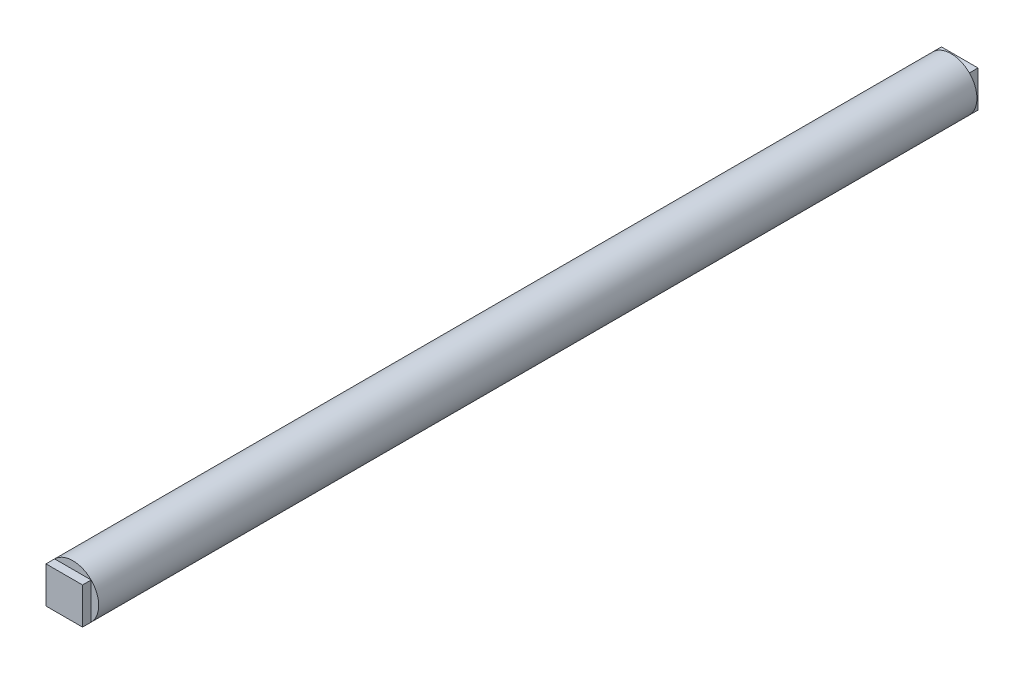
from build123d import *

# Parameters (mm, degrees)
MAIN_BAR_CROSS_SECTION_R = 3
BOSS_EXTRUDE1_DEPTH      = 102
SKETCH2_W                = 4.242640688
SKETCH2_H                = 4.242640688
BOSS_EXTRUDE2_DEPTH      = 1
SKETCH3_W                = 4.24
SKETCH3_H                = 4.245279732
BOSS_EXTRUDE3_DEPTH      = 1


with BuildPart() as part:
    # Main bar cross section → Boss-Extrude1 (new body)
    with BuildSketch(Plane.XY):
        Circle(MAIN_BAR_CROSS_SECTION_R)
    extrude(amount=BOSS_EXTRUDE1_DEPTH)

    # Sketch2 → Boss-Extrude2 (add)
    with BuildSketch(Plane(origin=(0, 0, 0), x_dir=(-1, 0, 0), z_dir=(0, 0, -1))):
        Rectangle(SKETCH2_W, SKETCH2_H)
    extrude(amount=BOSS_EXTRUDE2_DEPTH)

    # Sketch3 → Boss-Extrude3 (add)
    with BuildSketch(Plane.XY.offset(102)):
        Rectangle(SKETCH3_W, SKETCH3_H)
    extrude(amount=BOSS_EXTRUDE3_DEPTH)


solid = part.part
